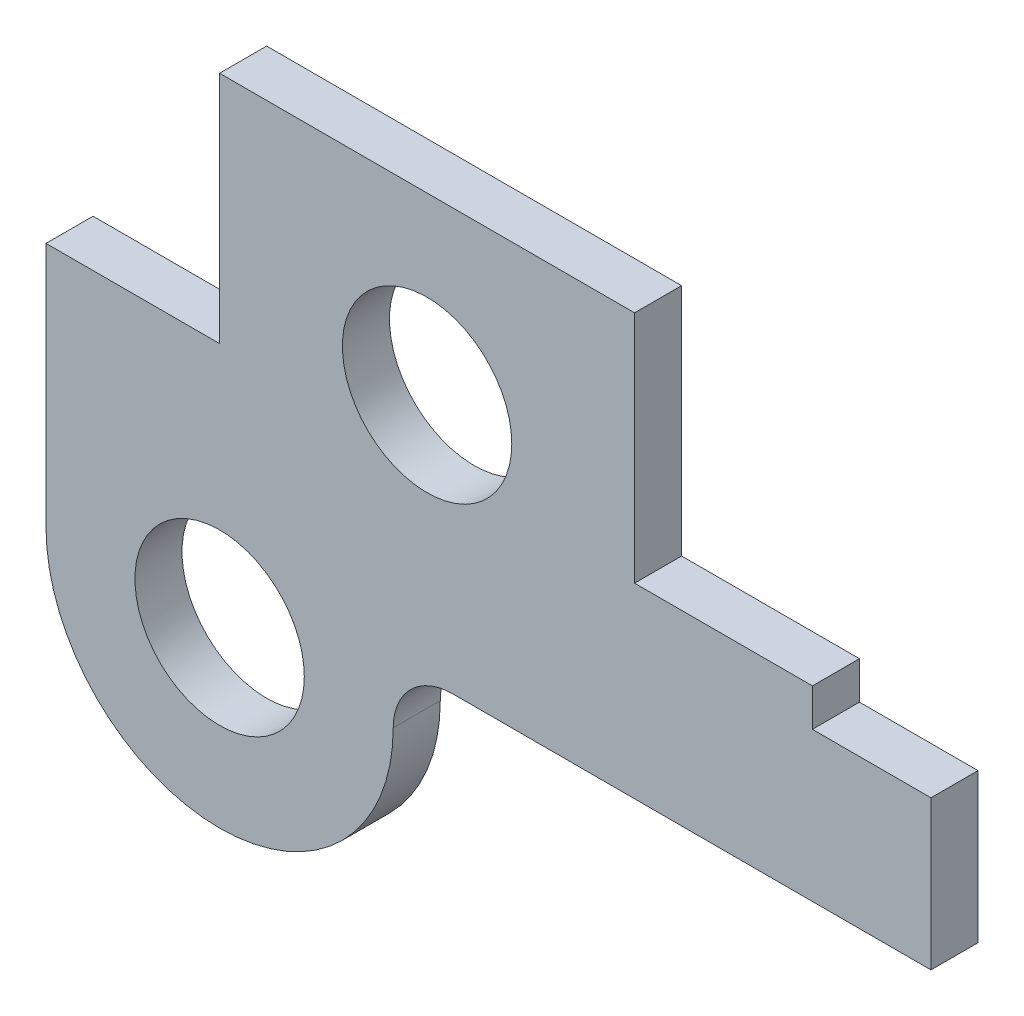
from build123d import *

# Parameters (mm, degrees)
SKETCH1_R           = 14.2875
BOSS_EXTRUDE1_DEPTH = 7.9375


with BuildPart() as part:
    # Sketch1 → Boss-Extrude1 (new body)
    with BuildSketch(Plane.XY):
        with BuildLine():
            Line((149.2875, 39.2875), (149.2875, 64.4375))
            Line((149.2875, 64.4375), (129.2875, 64.4375))
            Line((129.2875, 64.4375), (129.2875, 70.7875))
            Line((129.2875, 70.7875), (99.2875, 70.7875))
            Line((99.2875, 70.7875), (99.2875, 110.2875))
            Line((99.2875, 110.2875), (29.2875, 110.2875))
            Line((29.2875, 110.2875), (29.2875, 70.7875))
            Line((29.2875, 70.7875), (0, 70.7875))
            Line((0, 70.7875), (0, 29.2875))
            ThreePointArc((0, 29.2875), (29.2875, 0), (58.575, 29.2875))
            ThreePointArc((58.575, 29.2875), (61.503932188, 36.358567812), (68.575, 39.2875))
            Line((68.575, 39.2875), (149.2875, 39.2875))
        make_face()
        with Locations((64.2875, 80.7875)):
            Circle(SKETCH1_R, mode=Mode.SUBTRACT)
        with Locations((29.2875, 29.2875)):
            Circle(SKETCH1_R, mode=Mode.SUBTRACT)
    extrude(amount=BOSS_EXTRUDE1_DEPTH)


solid = part.part
